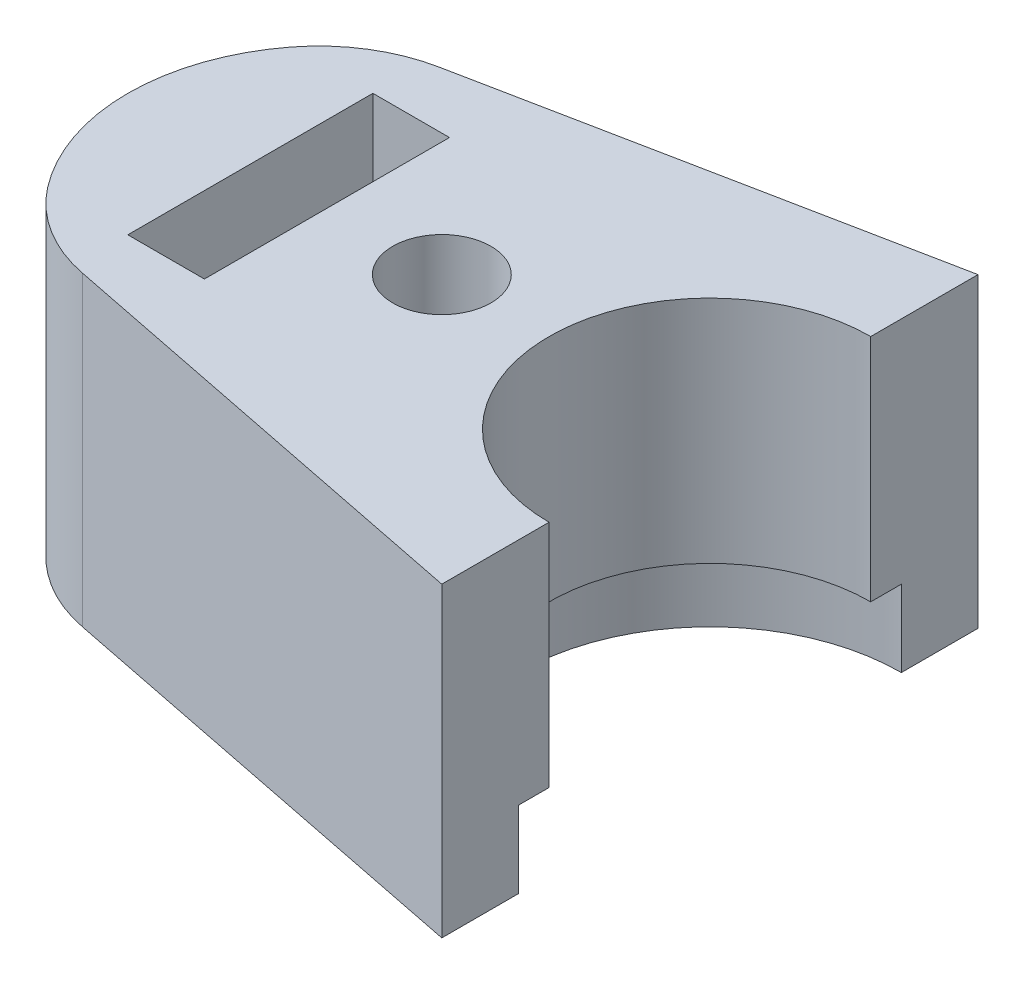
from build123d import *

# Parameters (mm, degrees)
SKETCH1_W           = 0.5
SKETCH1_H           = 1.6
SKETCH1_R           = 0.3207
BOSS_EXTRUDE1_DEPTH = 0.5
BOSS_EXTRUDE2_START = 0.5
SKETCH1_20_W        = 0.5
SKETCH1_20_H        = 1.6
SKETCH1_20_R        = 0.3207
BOSS_EXTRUDE2_DEPTH = 1.5


with BuildPart() as part:
    # Sketch1 → Boss-Extrude1 (new body)
    with BuildSketch(Plane(origin=(0, 0, 0), x_dir=(1, 0, 0), z_dir=(0, 1, 0))):
        with BuildLine():
            Line((-1.25, 1.25), (-1.25, 1.750241174))
            Line((-1.25, 1.750241174), (-4.183235691, 1.164159973))
            ThreePointArc((-4.183235691, 1.164159973), (-4.514100231, 1.033532975), (-4.77830642, 0.795352694))
            ThreePointArc((-4.77830642, 0.795352694), (-5.05, 0), (-4.77830642, -0.795352694))
            ThreePointArc((-4.77830642, -0.795352694), (-4.514100231, -1.033532975), (-4.183235691, -1.164159973))
            Line((-4.183235691, -1.164159973), (-1.25, -1.750241174))
            Line((-1.25, -1.750241174), (-1.25, -1.25))
            ThreePointArc((-1.25, -1.25), (-2.5, 0), (-1.25, 1.25))
        make_face()
        with Locations((-4, 0)):
            Rectangle(SKETCH1_W, SKETCH1_H, mode=Mode.SUBTRACT)
        with Locations((-3, 0)):
            Circle(SKETCH1_R, mode=Mode.SUBTRACT)
    extrude(amount=BOSS_EXTRUDE1_DEPTH)

    # Sketch1<20> → Boss-Extrude2 (add)
    with BuildSketch(Plane(origin=(0, 0, 0), x_dir=(1, 0, 0), z_dir=(0, 1, 0)).offset(BOSS_EXTRUDE2_START)):
        with BuildLine():
            Line((-1.25, 1.750241174), (-4.183235691, 1.164159973))
            ThreePointArc((-4.183235691, 1.164159973), (-4.514100231, 1.033532975), (-4.77830642, 0.795352694))
            ThreePointArc((-4.77830642, 0.795352694), (-5.05, 0), (-4.77830642, -0.795352694))
            ThreePointArc((-4.77830642, -0.795352694), (-4.514100231, -1.033532975), (-4.183235691, -1.164159973))
            Line((-4.183235691, -1.164159973), (-1.25, -1.750241174))
            Line((-1.25, -1.750241174), (-1.25, -1.05))
            ThreePointArc((-1.25, -1.05), (-2.3, 0), (-1.25, 1.05))
            Line((-1.25, 1.05), (-1.25, 1.750241174))
        make_face()
        with Locations((-4, 0)):
            Rectangle(SKETCH1_20_W, SKETCH1_20_H, mode=Mode.SUBTRACT)
        with Locations((-3, 0)):
            Circle(SKETCH1_20_R, mode=Mode.SUBTRACT)
    extrude(amount=BOSS_EXTRUDE2_DEPTH)


solid = part.part
